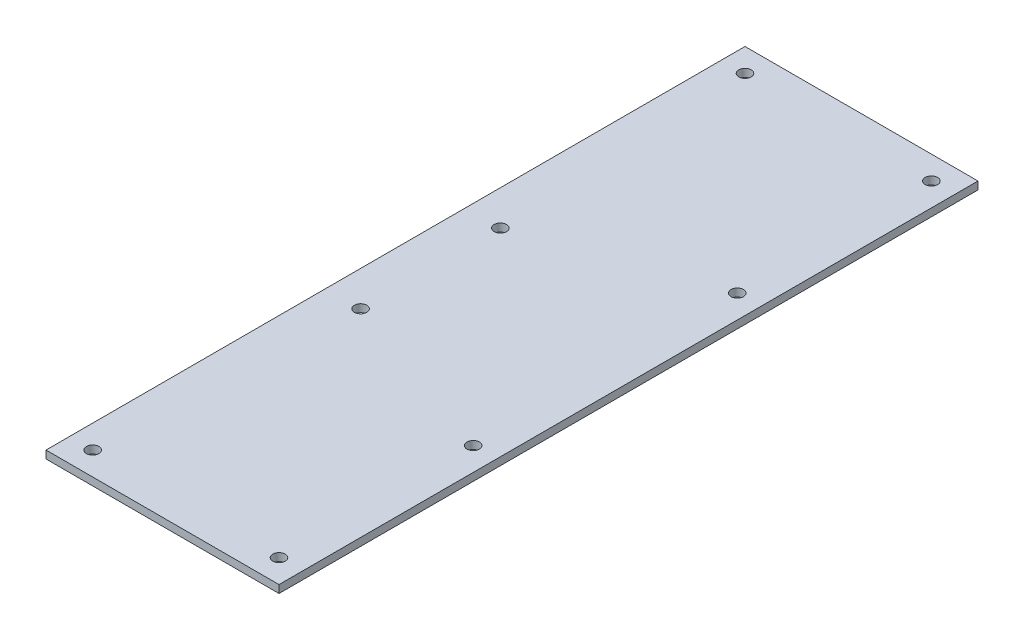
from build123d import *

# Parameters (mm, degrees)
SKETCH_1_W      = 60
SKETCH_1_H      = 180
SKETCH_1_R      = 1.6
EXTRUDE_1_DEPTH = 2


with BuildPart() as part:
    # 草图1 → 凸台-拉伸1 (new body)
    with BuildSketch(Plane(origin=(0, 0, 0), x_dir=(1, 0, 0), z_dir=(0, 1, 0))):
        with Locations((30, 90)):
            Rectangle(SKETCH_1_W, SKETCH_1_H)
        with Locations(Location((54, 56, 0), (0, 0, 270))):
            Circle(SKETCH_1_R, mode=Mode.SUBTRACT)
        with Locations(Location((54, 124, 0), (0, 0, 90))):
            Circle(SKETCH_1_R, mode=Mode.SUBTRACT)
        with Locations(Location((9, 108, 0), (0, 0, 270))):
            Circle(SKETCH_1_R, mode=Mode.SUBTRACT)
        with Locations(Location((9, 72, 0), (0, 0, 90))):
            Circle(SKETCH_1_R, mode=Mode.SUBTRACT)
        with Locations(Location((6, 174, 0), (0, 0, 270))):
            Circle(SKETCH_1_R, mode=Mode.SUBTRACT)
        with Locations(Location((54, 174, 0), (0, 0, 90))):
            Circle(SKETCH_1_R, mode=Mode.SUBTRACT)
        with Locations(Location((54, 6, 0), (0, 0, 270))):
            Circle(SKETCH_1_R, mode=Mode.SUBTRACT)
        with Locations(Location((6, 6, 0), (0, 0, 90))):
            Circle(SKETCH_1_R, mode=Mode.SUBTRACT)
    extrude(amount=EXTRUDE_1_DEPTH)


solid = part.part
